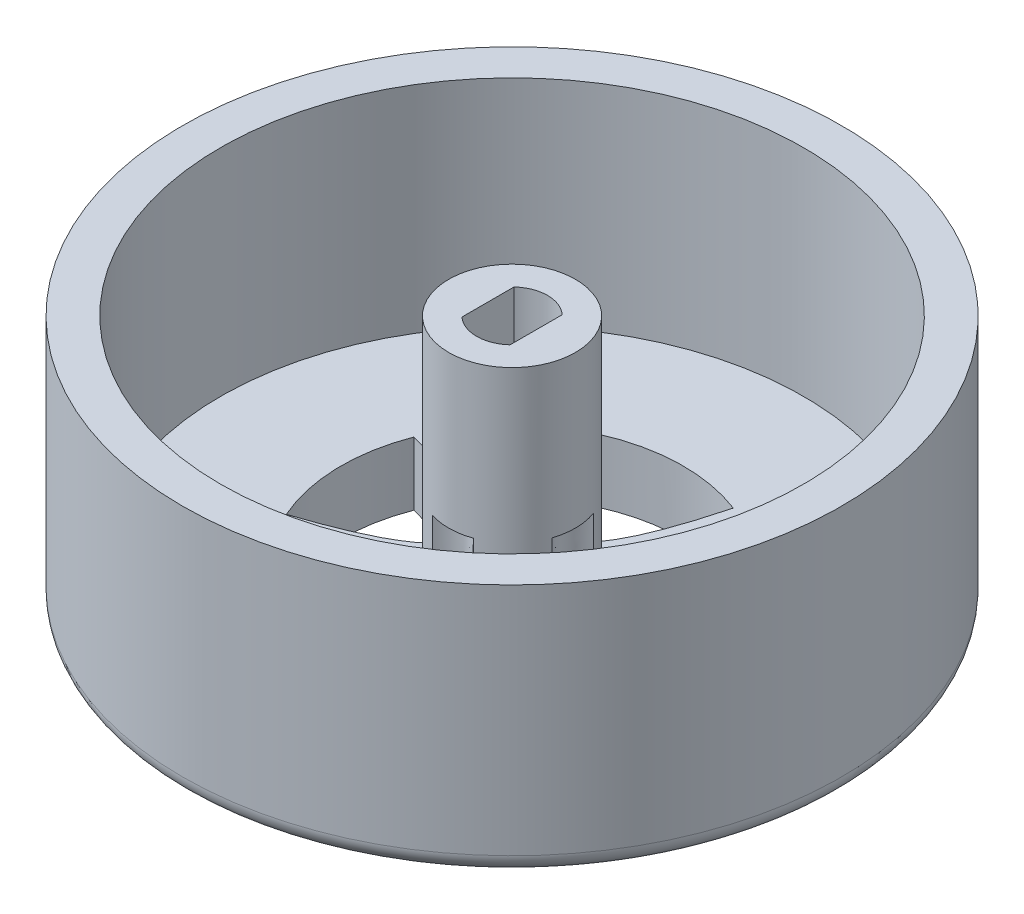
from build123d import *

# Parameters (mm, degrees)
CROQUIS1_R              = 26
SALIENTE_EXTRUIR1_DEPTH = 20
VACIADO1_T              = -3
REDONDEO1_R             = 1.5
CROQUIS2_R              = 15
SALIENTE_EXTRUIR2_DEPTH = 2
REDONDEO2_R             = 1.5
CROQUIS5_R              = 5
SALIENTE_EXTRUIR3_DEPTH = 17
CORTAR_EXTRUIR3_DEPTH   = 7
CORTAR_EXTRUIR5_DEPTH   = 10
CROQUIS12_R             = 2.975585662
CORTAR_EXTRUIR4_DEPTH   = 12


with BuildPart() as part:
    # Croquis1 → Saliente-Extruir1 (new body)
    with BuildSketch(Plane(origin=(0, 0, 0), x_dir=(1, 0, 0), z_dir=(0, 1, 0))):
        with Locations(Location((0, 0, 0), (0, 0, 270))):
            Circle(CROQUIS1_R)
    extrude(amount=SALIENTE_EXTRUIR1_DEPTH)

    # Vaciado1
    vaciado1_openings = [part.faces().sort_by_distance(p)[0] for p in [
        (0, 20, 0),
    ]]
    offset(amount=VACIADO1_T, openings=vaciado1_openings, kind=Kind.INTERSECTION)

    # Redondeo1
    redondeo1_edges = [part.edges().sort_by_distance(p)[0] for p in [
        (0, 0, -26),
    ]]
    fillet(redondeo1_edges, radius=REDONDEO1_R)

    # Croquis2 → Saliente-Extruir2 (add)
    with BuildSketch(Plane.XZ):
        with Locations(Location((0, 0, 0), (0, 0, 90))):
            Circle(CROQUIS2_R)
    extrude(amount=SALIENTE_EXTRUIR2_DEPTH)

    # Redondeo2
    redondeo2_edges = [part.edges().sort_by_distance(p)[0] for p in [
        (0, -2, -15),
    ]]
    fillet(redondeo2_edges, radius=REDONDEO2_R)

    # Croquis5 → Saliente-Extruir3 (add)
    with BuildSketch(Plane(origin=(0, 3, 0), x_dir=(1, 0, 0), z_dir=(0, 1, 0))):
        with Locations(Location((0, 0, 0), (0, 0, 270))):
            Circle(CROQUIS5_R)
    extrude(amount=SALIENTE_EXTRUIR3_DEPTH)

    # Croquis6 → Cortar-Extruir3 (cut)
    with BuildSketch(Plane(origin=(0, 20, 0), x_dir=(1, 0, 0), z_dir=(0, 1, 0))):
        with BuildLine():
            ThreePointArc((1.9, 2.05669638), (0, 2.8), (-1.9, 2.05669638))
            Line((-1.9, 2.05669638), (-1.9, -2.05669638))
            ThreePointArc((-1.9, -2.05669638), (0, -2.8), (1.9, -2.05669638))
            Line((1.9, -2.05669638), (1.9, 2.05669638))
        make_face()
    extrude(amount=-CORTAR_EXTRUIR3_DEPTH, mode=Mode.SUBTRACT)

    # Croquis10 → Refrentado para tornillo con cabeza troncocónica de M2.51 (revolve, cut)
    with BuildSketch(Plane(origin=(0, -2, 0), x_dir=(0, 0, -1), z_dir=(1, 0, 0))):
        Polygon((0, 0), (0, 22), (1.45, 22), (1.45, 2.1), (3, 2.1), (3, 0), align=None)
    revolve(axis=Axis((0, -8.35, 0), (0, 1, 0)), mode=Mode.SUBTRACT)

    # Croquis4 → Cortar-Extruir5 (cut)
    with BuildSketch(Plane.XZ.offset(2)):
        with BuildLine():
            ThreePointArc((-5.465091238, -12.344341933), (-0.32920888, -13.495985385), (4.856716063, -12.59612278))
            add(Edge.make_bspline(
                [(4.856716063, -12.59612278), (0.260062293, 4.863404328), (-5.465091238, -12.344341933)],
                knots=[0.092611361, 0.092611361, 0.092611361, 0.907859472, 0.907859472, 0.907859472], degree=2))
        make_face()
        with BuildLine():
            add(Edge.make_bspline(
                [(-12.59612278, -4.856716063), (4.863404328, -0.260062293), (-12.344341933, 5.465091238)],
                knots=[0.092611361, 0.092611361, 0.092611361, 0.907859472, 0.907859472, 0.907859472], degree=2))
            ThreePointArc((-12.344341933, 5.465091238), (-13.495985385, 0.32920888), (-12.59612278, -4.856716063))
        make_face()
        with BuildLine():
            add(Edge.make_bspline(
                [(-4.564383108, 12.704975673), (-0.276925472, -4.973532137), (5.206643951, 12.455555338)],
                knots=[0.037040057, 0.037040057, 0.037040057, 0.963168016, 0.963168016, 0.963168016], degree=2))
            ThreePointArc((5.206643951, 12.455555338), (0.344495825, 13.495603826), (-4.564383108, 12.704975673))
        make_face()
        with BuildLine():
            ThreePointArc((13.5, 0), (13.272107171, 2.470054906), (12.59612278, 4.856716063))
            add(Edge.make_bspline(
                [(12.59612278, 4.856716063), (-4.863404328, 0.260062293), (12.344341933, -5.465091238)],
                knots=[0.092611361, 0.092611361, 0.092611361, 0.907859472, 0.907859472, 0.907859472], degree=2))
            ThreePointArc((12.344341933, -5.465091238), (13.207925956, -2.792971885), (13.5, 0))
        make_face()
    extrude(amount=-CORTAR_EXTRUIR5_DEPTH, mode=Mode.SUBTRACT)

    # Croquis12 → Cortar-Extruir4 (cut)
    with BuildSketch(Plane.XZ.offset(-0.1)):
        with Locations(Location((0, 0, 0), (0, 0, 270))):
            Circle(CROQUIS12_R)
    extrude(amount=-CORTAR_EXTRUIR4_DEPTH, mode=Mode.SUBTRACT)


solid = part.part
